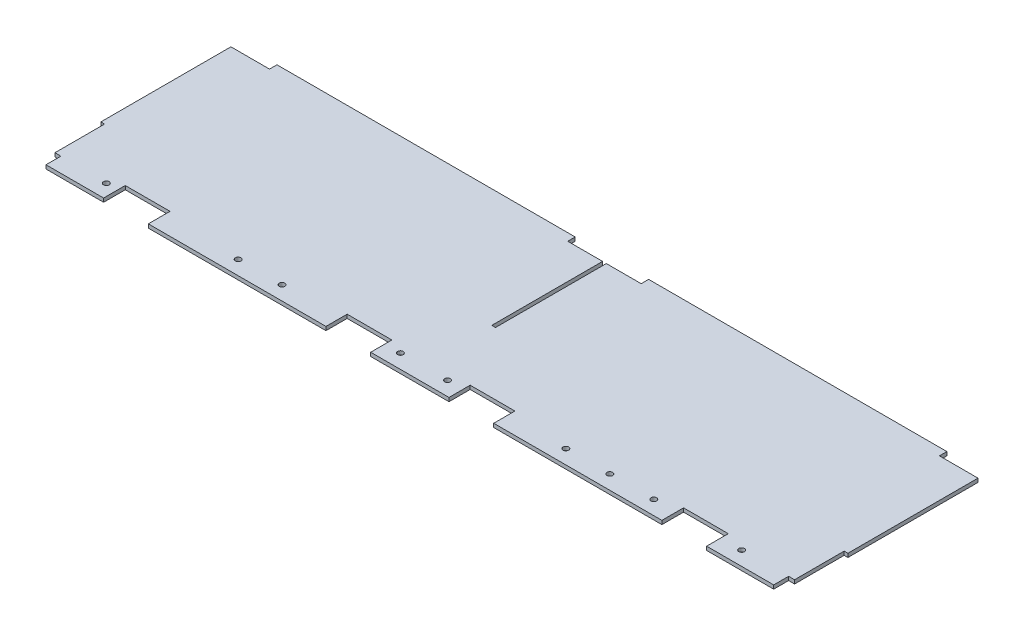
from build123d import *

# Parameters (mm, degrees)
SKETCH1_W            = 629.90984
SKETCH1_H            = 147.69846
BOSS_EXTRUDE1_DEPTH  = 3.175
SKETCH3_W            = 254
SKETCH3_H            = 3.175
BOSS_EXTRUDE2_DEPTH  = 6.35
SKETCH4_W            = 3.175
SKETCH4_H            = 188.732840052
CUT_EXTRUDE1_DEPTH   = 3.175
SKETCH6_W            = 3.175
SKETCH6_H            = 110.773845
BOSS_EXTRUDE4_DEPTH  = 3.175
SKETCH8_W            = 629.90984
SKETCH8_H            = 18.04416
BOSS_EXTRUDE5_DEPTH  = 3.175
SKETCH10_W           = 38.1
SKETCH10_H           = 36.08832
CUT_EXTRUDE3_DEPTH   = 652.56536379
SKETCH12_W           = 38.1
SKETCH12_H           = 18.04416
BOSS_EXTRUDE7_DEPTH  = 3.175
SKETCH17_W           = 38.1
SKETCH17_H           = 18.04416
CUT_EXTRUDE5_DEPTH   = 652.56536379
SKETCH18_W           = 38.1
SKETCH18_H           = 18.450049938
CUT_EXTRUDE6_DEPTH   = 652.56536379
SKETCH24_W           = 5.08
SKETCH24_H           = 12.7
CUT_EXTRUDE11_DEPTH  = 652.56536379
M4_CLEARANCE_HOLE3_D = 4.8


with BuildPart() as part:
    # Sketch1 → Boss-Extrude1 (new body)
    with BuildSketch(Plane(origin=(0, 0, 0), x_dir=(1, 0, 0), z_dir=(0, 1, 0))):
        with Locations((314.95492, 73.84923)):
            Rectangle(SKETCH1_W, SKETCH1_H)
    extrude(amount=BOSS_EXTRUDE1_DEPTH)

    # Sketch3 → Boss-Extrude2 (add)
    with BuildSketch(Plane(origin=(0, 0, -147.69846), x_dir=(-1, 0, 0), z_dir=(0, 0, -1))):
        with Locations((-473.22613, 1.5875)):
            Rectangle(SKETCH3_W, SKETCH3_H)
        with Locations((-156.68371, 1.5875)):
            Rectangle(SKETCH3_W, SKETCH3_H)
    extrude(amount=BOSS_EXTRUDE2_DEPTH)

    # Sketch4 → Cut-Extrude1 (cut)
    with BuildSketch(Plane(origin=(0, 3.175, 0), x_dir=(1, 0, 0), z_dir=(0, 1, 0))):
        with Locations((314.95492, 147.69846)):
            Rectangle(SKETCH4_W, SKETCH4_H)
    extrude(amount=-CUT_EXTRUDE1_DEPTH, mode=Mode.SUBTRACT)

    # Sketch6 → Boss-Extrude4 (add)
    with BuildSketch(Plane(origin=(0, 3.175, 0), x_dir=(1, 0, 0), z_dir=(0, 1, 0))):
        with Locations((631.49734, 92.3115375)):
            Rectangle(SKETCH6_W, SKETCH6_H)
        with Locations((-1.5875, 92.3115375)):
            Rectangle(SKETCH6_W, SKETCH6_H)
    extrude(amount=-BOSS_EXTRUDE4_DEPTH)

    # Sketch8 → Boss-Extrude5 (add, through all)
    with BuildSketch(Plane(origin=(0, 3.175, 0), x_dir=(1, 0, 0), z_dir=(0, 1, 0))):
        with Locations((314.95492, -9.02208)):
            Rectangle(SKETCH8_W, SKETCH8_H)
    extrude(amount=-BOSS_EXTRUDE5_DEPTH)

    # Sketch10 → Cut-Extrude3 (cut, through all)
    with BuildSketch(Plane(origin=(0, 3.175, 0), x_dir=(1, 0, 0), z_dir=(0, 1, 0))):
        with Locations((579.10984, -18.04416)):
            Rectangle(SKETCH10_W, SKETCH10_H)
        with Locations((50.8, -18.04416)):
            Rectangle(SKETCH10_W, SKETCH10_H)
    extrude(amount=-CUT_EXTRUDE3_DEPTH, mode=Mode.SUBTRACT)

    # Sketch12 → Boss-Extrude7 (add, through all)
    with BuildSketch(Plane(origin=(0, 3.175, 0), x_dir=(1, 0, 0), z_dir=(0, 1, 0))):
        with Locations((50.8, -9.02208)):
            Rectangle(SKETCH12_W, SKETCH12_H)
        with Locations((579.10984, -9.02208)):
            Rectangle(SKETCH12_W, SKETCH12_H)
    extrude(amount=-BOSS_EXTRUDE7_DEPTH)

    # Sketch17 → Cut-Extrude5 (cut, through all)
    with BuildSketch(Plane(origin=(0, 3.175, 0), x_dir=(1, 0, 0), z_dir=(0, 1, 0))):
        with Locations((262.56742, -9.02208)):
            Rectangle(SKETCH17_W, SKETCH17_H)
        with Locations((367.34242, -9.02208)):
            Rectangle(SKETCH17_W, SKETCH17_H)
    extrude(amount=-CUT_EXTRUDE5_DEPTH, mode=Mode.SUBTRACT)

    # Sketch18 → Cut-Extrude6 (cut, through all)
    with BuildSketch(Plane(origin=(0, 3.175, 0), x_dir=(1, 0, 0), z_dir=(0, 1, 0))):
        with Locations((73.1774, -8.819135031)):
            Rectangle(SKETCH18_W, SKETCH18_H)
        with Locations((548.657320006, -8.819135031)):
            Rectangle(SKETCH18_W, SKETCH18_H)
    extrude(amount=-CUT_EXTRUDE6_DEPTH, mode=Mode.SUBTRACT)

    # Sketch24 → Cut-Extrude11 (cut, through all)
    with BuildSketch(Plane(origin=(0, 3.175, 0), x_dir=(1, 0, 0), z_dir=(0, 1, 0))):
        with Locations((2.54, -11.69416)):
            Rectangle(SKETCH24_W, SKETCH24_H)
        with Locations((627.36984, -11.69416)):
            Rectangle(SKETCH24_W, SKETCH24_H)
    extrude(amount=-CUT_EXTRUDE11_DEPTH, mode=Mode.SUBTRACT)

    # M4 Clearance Hole3 (through all)
    with Locations(Plane(origin=(0, 3.175, 0), x_dir=(1, 0, 0), z_dir=(0, 1, 0))):
        with Locations((44.409412743, -5.996840051), (156.68371, -5.996840051), (194.108475752, -5.996840051), (294.859886505, -5.996840051), (335.049953495, -5.996840051), (435.801364248, -5.996840051), (473.22613, -5.996840051), (510.650895752, -5.996840051), (585.500427257, -5.996840051)):
            Hole(M4_CLEARANCE_HOLE3_D / 2)


solid = part.part
